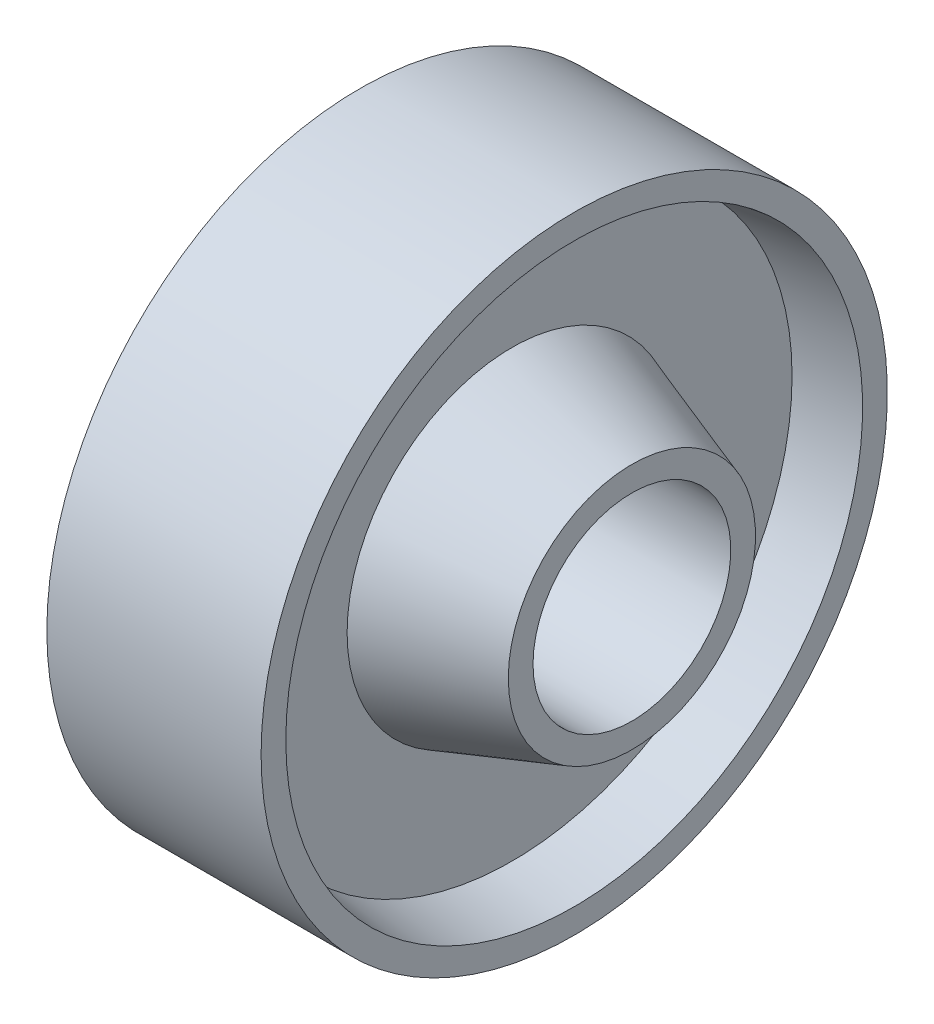
from build123d import *


with BuildPart() as part:
    # Sketch3 → Revolve1 (revolve)
    with BuildSketch(Plane.XY, mode=Mode.PRIVATE) as revolve1_sk:
        Polygon((-21.013824885, 12), (18.986175115, 12), (18.986175115, 15), (4.423963134, 20), (4.423963134, 34), (11.986175115, 35), (11.986175115, 38), (-14.013824885, 38), (-14.013824885, 35), (-6.451612903, 34), (-6.451612903, 20), (-21.013824885, 15), align=None)
    revolve(revolve1_sk.sketch.rotate(Axis((-39.078341014, 0, 0), (1, 0, 0)), 90), axis=Axis((-39.078341014, 0, 0), (1, 0, 0)))


solid = part.part
